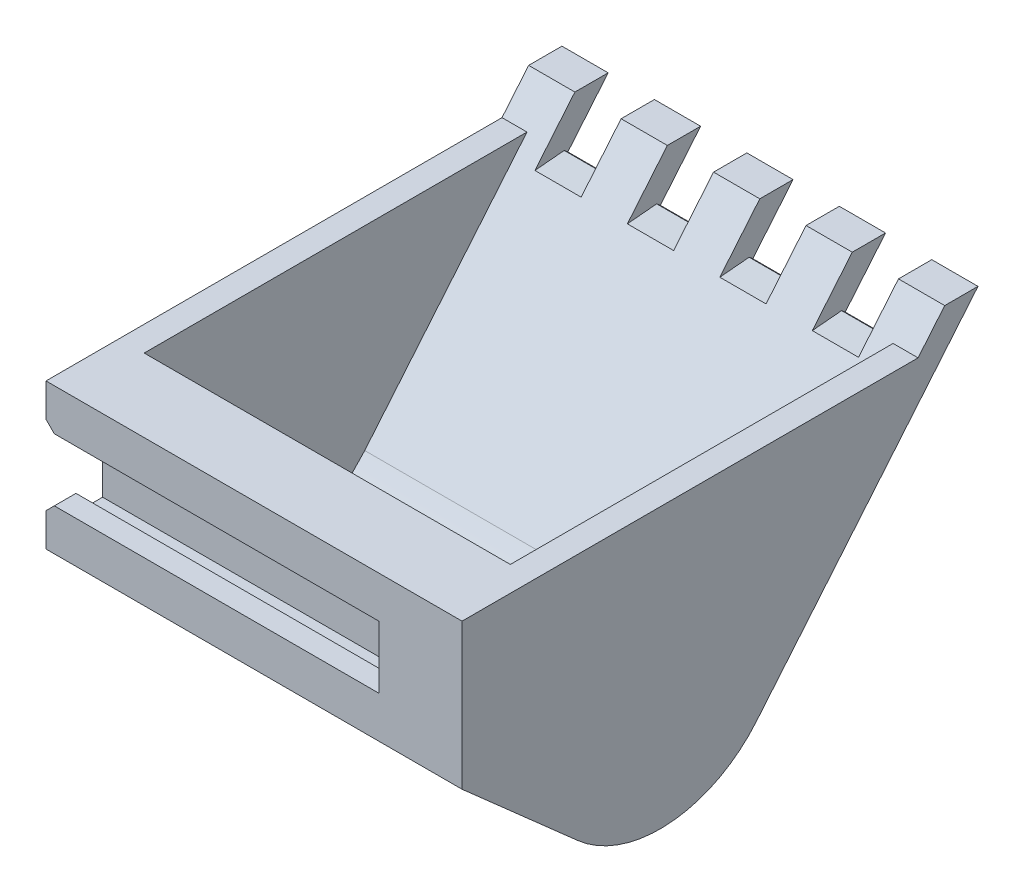
from build123d import *

# Parameters (mm, degrees)
BOSS_EXTRUDE1_DEPTH = 50
BOSS_EXTRUDE2_DEPTH = 10
FILLET1_R           = 15
CUT_EXTRUDE1_START  = -3
CUT_EXTRUDE1_DEPTH  = 44
FILLET2_R           = 15
BOSS_EXTRUDE3_DEPTH = 50
SKETCH5_W           = 5.55555544444444
SKETCH5_H           = 7.560737598657919
SKETCH5_W_2         = 5.5555554444444475
SKETCH5_W_3         = 5.555555444444444
CUT_EXTRUDE2_DEPTH  = 68.02665161849878
CHAMFER1_SIZE       = 2.5
CHAMFER2_SIZE       = 1


with BuildPart() as part:
    # Sketch1 → Boss-Extrude1 (new body)
    with BuildSketch(Plane(origin=(0, 0, 0), x_dir=(0, 0, -1), z_dir=(1, 0, 0))):
        Polygon((0, 0), (50.00000000000001, 0), (16.66666666666667, -40), (-8.800000000000015, -17.499999999999996), (-8.800000000000015, -12.499999999999998), (-6.200000000000014, -12.499999999999998), (-6.200000000000013, -14.499999999999998), (-2.9999999999999982, -14.499999999999998), (-2.9999999999999982, -3), (-6.200000000000013, -3), (-6.200000000000014, -4.999999999999999), (-8.800000000000015, -4.999999999999999), (-8.800000000000017, -1.08e-15), align=None)
    extrude(amount=BOSS_EXTRUDE1_DEPTH)

    # Sketch2 → Boss-Extrude2 (add)
    with BuildSketch(Plane(origin=(50, 0, 0), x_dir=(0, 0, -1), z_dir=(1, 0, 0))):
        Polygon((-8.800000000000017, -1.08e-15), (-0.800000000000016, 0), (-0.8000000000000138, -17.499999999999996), (-8.800000000000015, -17.499999999999996), align=None)
    extrude(amount=-BOSS_EXTRUDE2_DEPTH)

    # Fillet1
    fillet1_edges = [part.edges().sort_by_distance(p)[0] for p in [
        (25, -40, -16.66666666666667),
    ]]
    fillet(fillet1_edges, radius=FILLET1_R)

    # Sketch3 → Cut-Extrude1 (cut)
    with BuildSketch(Plane(origin=(50, 0, 0), x_dir=(0, 0, -1), z_dir=(1, 0, 0)).offset(CUT_EXTRUDE1_START)):
        with BuildLine():
            Line((46.000000000000014, 0), (26.501646387603547, -23.398024334875757))
            add(Edge.make_bspline(
                [(0, -15), (11.33309259276565, -40.236961436031486), (26.501646387603547, -23.398024334875757)],
                knots=[0, 0, 0, 1, 1, 1], degree=2))
            Line((0, -15), (0, 0))
            Line((0, 0), (46.000000000000014, 0))
        make_face()
    extrude(amount=-CUT_EXTRUDE1_DEPTH, mode=Mode.SUBTRACT)

    # Fillet2
    fillet2_edges = [part.edges().sort_by_distance(p)[0] for p in [
        (25, -15, 0),
    ]]
    fillet(fillet2_edges, radius=FILLET2_R)

    # Sketch4 → Boss-Extrude3 (add, through all)
    with BuildSketch(Plane(origin=(50, 0, 0), x_dir=(0, 0, -1), z_dir=(1, 0, 0))):
        Polygon((50.00000000000001, 0), (46.000000000000014, 0), (49.20092199832241, 3.841106397986878), (53.20092199832241, 3.841106397986878), align=None)
    extrude(amount=-BOSS_EXTRUDE3_DEPTH)

    # Sketch5 → Cut-Extrude2 (cut, through all)
    with BuildSketch(Plane(origin=(0, -22.622950819672138, -27.147540983606568), x_dir=(1, 0, 0), z_dir=(0, 0.6401843996644799, 0.7682212795973757))):
        Polygon((11.111111, 29.44848238456608), (11.111111, 37.009219983224), (5.555555555555555, 37.009219983224), (5.555555555555556, 29.44848238456608), align=None)
        with Locations((19.444444277777777, 33.22885118389504)):
            Rectangle(SKETCH5_W, SKETCH5_H)
        with Locations((30.555555277777778, 33.22885118389504)):
            Rectangle(SKETCH5_W_2, SKETCH5_H)
        with Locations((41.66666627777778, 33.22885118389504)):
            Rectangle(SKETCH5_W_3, SKETCH5_H)
    extrude(amount=-CUT_EXTRUDE2_DEPTH, mode=Mode.SUBTRACT)

    # Chamfer1
    chamfer1_edges = [part.edges().sort_by_distance(p)[0] for p in [
        (8.333333277777777, -3.55e-15, -46.000000000000014),
        (19.444444277777777, -3.55e-15, -46.000000000000014),
        (30.555555277777778, -3.55e-15, -46.000000000000014),
        (41.66666627777778, -3.55e-15, -46.000000000000014),
    ]]
    chamfer(chamfer1_edges, length=CHAMFER1_SIZE)

    # Chamfer2
    chamfer2_edges = [part.edges().sort_by_distance(p)[0] for p in [
        (0, -12.499999999999998, 7.500000000000014),
        (0, -13.499999999999998, 6.2000000000000135),
        (0, -14.499999999999998, 4.600000000000005),
        (0, -8.75, 2.9999999999999982),
        (0, -3, 4.600000000000005),
        (0, -3.9999999999999996, 6.2000000000000135),
        (0, -4.999999999999999, 7.500000000000014),
    ]]
    chamfer(chamfer2_edges, length=CHAMFER2_SIZE)


solid = part.part
